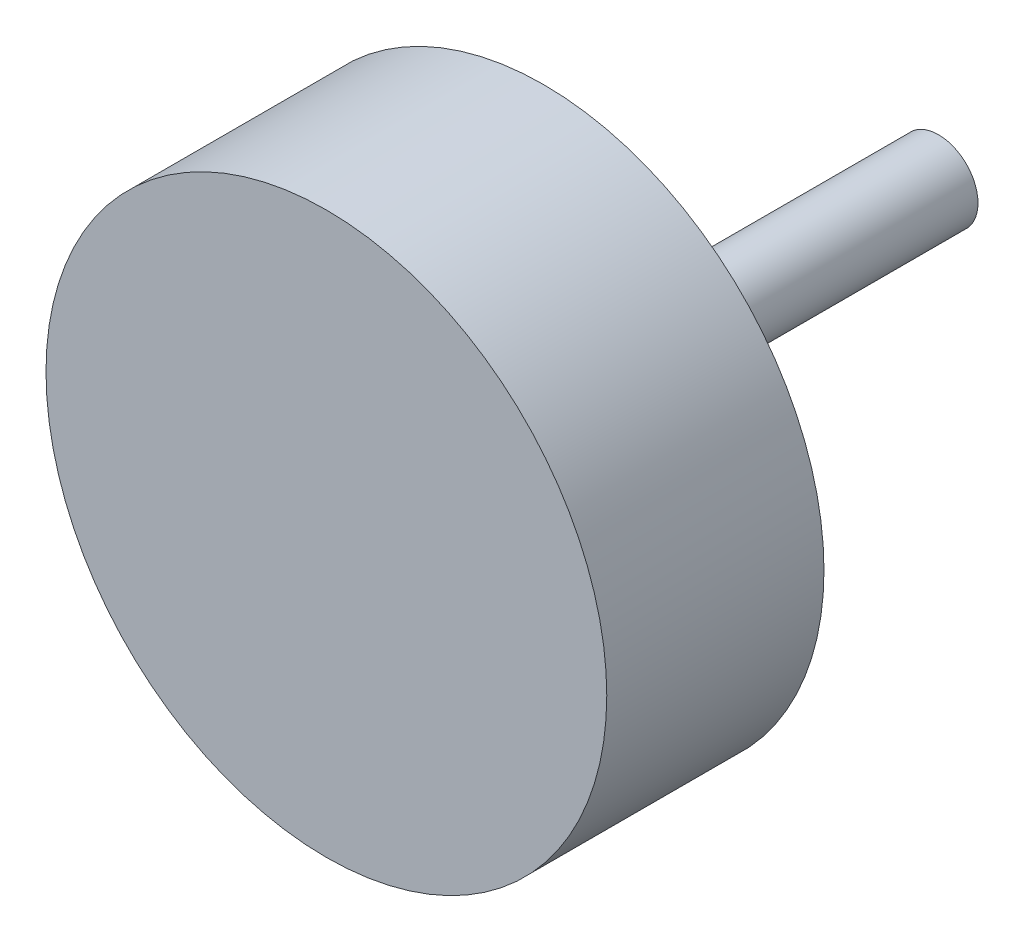
from build123d import *

# Parameters (mm, degrees)
SKETCH1_R           = 7.1
BOSS_EXTRUDE1_DEPTH = 5.5
SKETCH2_R           = 1
BOSS_EXTRUDE2_DEPTH = 10


with BuildPart() as part:
    # Sketch1 → Boss-Extrude1 (new body)
    with BuildSketch(Plane.XY):
        Circle(SKETCH1_R)
    extrude(amount=BOSS_EXTRUDE1_DEPTH)

    # Sketch2 → Boss-Extrude2 (add)
    with BuildSketch(Plane(origin=(0, 0, 0), x_dir=(-1, 0, 0), z_dir=(0, 0, -1))):
        with Locations(Location((0, 0, 0), (0, 0, 180))):
            Circle(SKETCH2_R)
    extrude(amount=BOSS_EXTRUDE2_DEPTH)


solid = part.part
